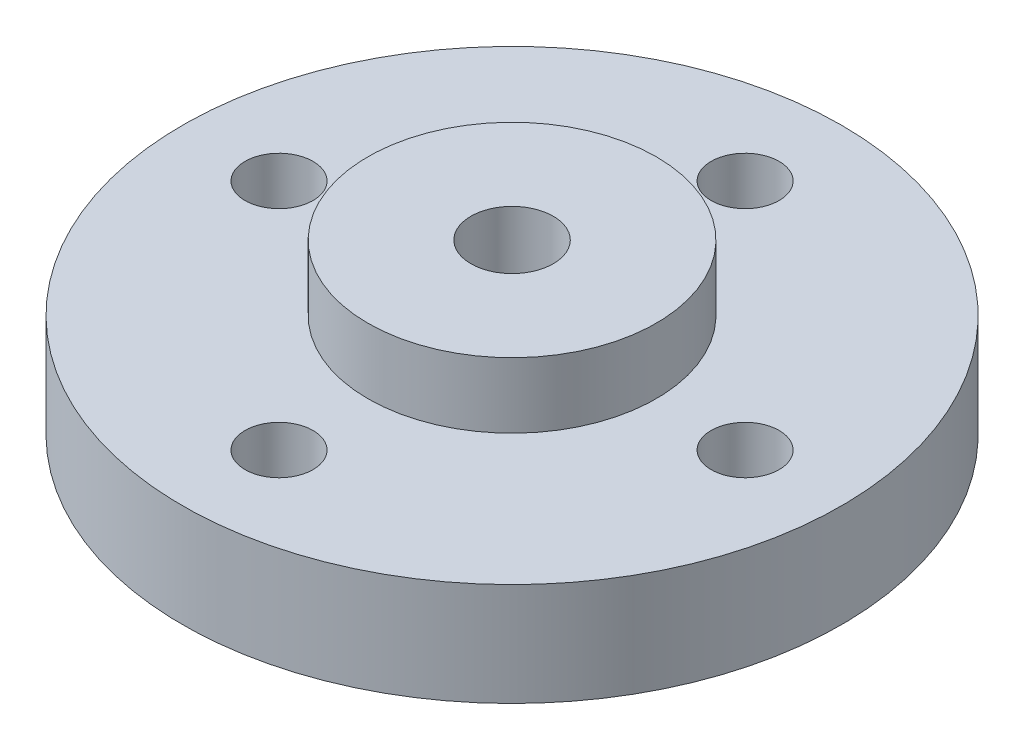
from build123d import *

# Parameters (mm, degrees)
SKETCH1_R           = 7
SKETCH1_R_2         = 2
BOSS_EXTRUDE1_DEPTH = 3.175
SKETCH2_R           = 16
SKETCH2_R_2         = 1.65
BOSS_EXTRUDE2_DEPTH = 5


with BuildPart() as part:
    # Sketch1 → Boss-Extrude1 (new body)
    with BuildSketch(Plane(origin=(0, 0, 0), x_dir=(1, 0, 0), z_dir=(0, 1, 0))):
        with Locations(Location((0, 0, 0), (0, 0, 270))):
            Circle(SKETCH1_R)
        with Locations(Location((0, 0, 0), (0, 0, 270))):
            Circle(SKETCH1_R_2, mode=Mode.SUBTRACT)
    extrude(amount=BOSS_EXTRUDE1_DEPTH)


with BuildPart() as body_2:
    # Sketch2 → Boss-Extrude2 (new body)
    with BuildSketch(Plane(origin=(0, 0, 0), x_dir=(-1, 0, 0), z_dir=(0, -1, 0))):
        with Locations(Location((0, 0, 0), (0, 0, 90))):
            Circle(SKETCH2_R)
        with Locations(Location((11.313708499, 0, 0), (0, 0, 90))):
            Circle(SKETCH2_R_2, mode=Mode.SUBTRACT)
        with Locations(Location((0, 11.313708499, 0), (0, 0, 90))):
            Circle(SKETCH2_R_2, mode=Mode.SUBTRACT)
        with Locations(Location((-11.313708499, 0, 0), (0, 0, 90))):
            Circle(SKETCH2_R_2, mode=Mode.SUBTRACT)
        with Locations(Location((0, -11.313708499, 0), (0, 0, 90))):
            Circle(SKETCH2_R_2, mode=Mode.SUBTRACT)
        Polygon((3.914434825, 0), (1.957217413, 3.39), (-1.957217413, 3.39), (-3.914434825, 0), (-1.957217413, -3.39), (1.957217413, -3.39), align=None, mode=Mode.SUBTRACT)
    extrude(amount=BOSS_EXTRUDE2_DEPTH)


solid = Compound([part.part, body_2.part])
